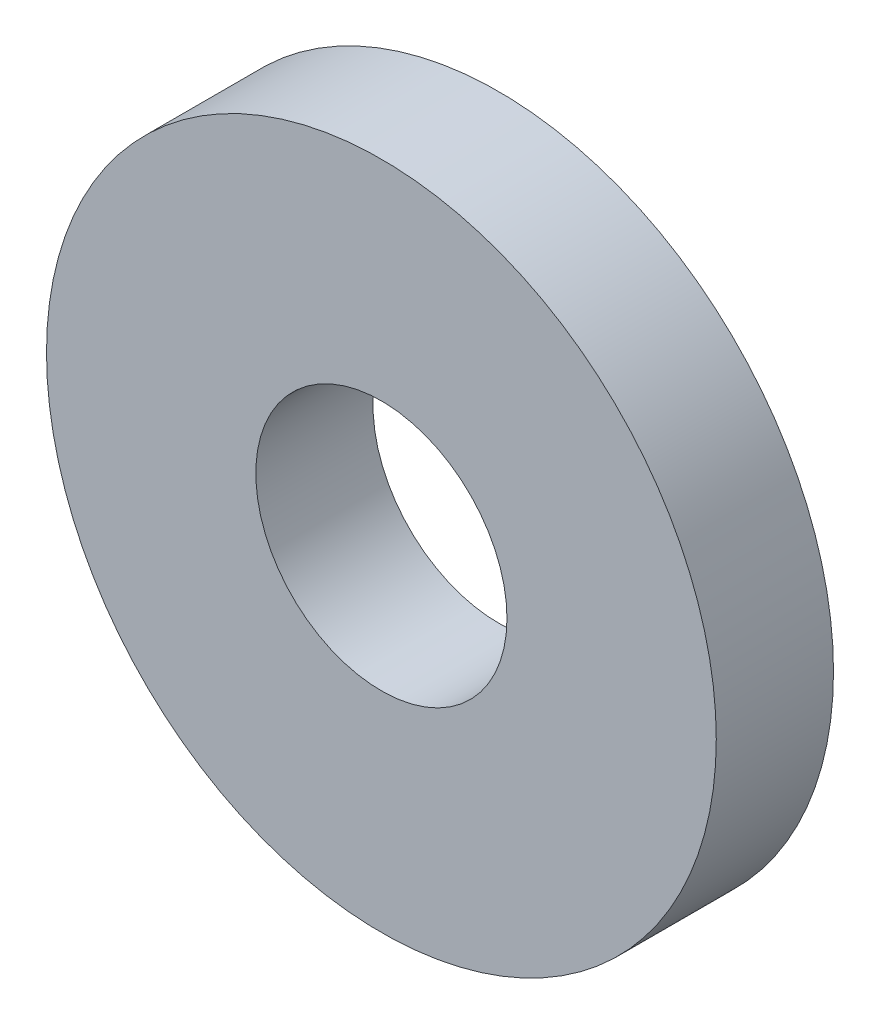
from build123d import *

# Parameters (mm, degrees)
SKETCH1_R           = 20
SKETCH1_R_2         = 7.5
BOSS_EXTRUDE1_DEPTH = 7


with BuildPart() as part:
    # Sketch1 → Boss-Extrude1 (new body)
    with BuildSketch(Plane.XY):
        Circle(SKETCH1_R)
        Circle(SKETCH1_R_2, mode=Mode.SUBTRACT)
    extrude(amount=BOSS_EXTRUDE1_DEPTH)


solid = part.part
